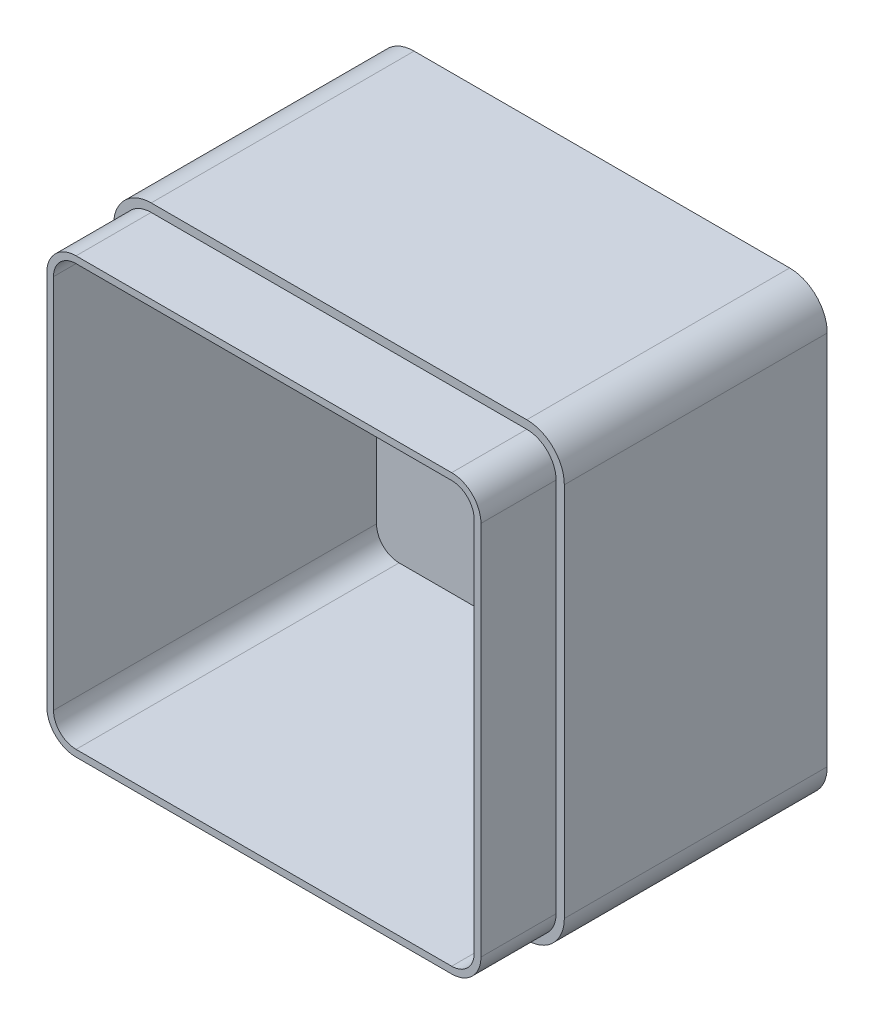
from build123d import *

# Parameters (mm, degrees)
SKETCH2_W           = 120
SKETCH2_H           = 120
BOSS_EXTRUDE1_DEPTH = 90
FILLET1_R           = 10
SHELL1_T            = -4
CUT_EXTRUDE1_DEPTH  = 20


with BuildPart() as part:
    # Sketch2 → Boss-Extrude1 (new body)
    with BuildSketch(Plane.XY):
        with Locations((60, 60)):
            Rectangle(SKETCH2_W, SKETCH2_H)
    extrude(amount=BOSS_EXTRUDE1_DEPTH)

    # Fillet1
    fillet1_edges = [part.edges().sort_by_distance(p)[0] for p in [
        (0, 120, 45),
        (120, 120, 45),
        (120, 0, 45),
        (0, 0, 45),
    ]]
    fillet(fillet1_edges, radius=FILLET1_R)

    # Shell1
    shell1_openings = [part.faces().sort_by_distance(p)[0] for p in [
        (60, 60, 90),
    ]]
    offset(amount=SHELL1_T, openings=shell1_openings, kind=Kind.INTERSECTION)

    # Sketch4 → Cut-Extrude1 (cut)
    with BuildSketch(Plane.XY.offset(90)):
        with BuildLine():
            Line((0, 110), (0, 10))
            ThreePointArc((0, 10), (2.928932188, 2.928932188), (10, 0))
            Line((10, 0), (110, 0))
            ThreePointArc((110, 0), (117.071067812, 2.928932188), (120, 10))
            Line((120, 10), (120, 110))
            ThreePointArc((120, 110), (117.071067812, 117.071067812), (110, 120))
            Line((110, 120), (10, 120))
            ThreePointArc((10, 120), (2.928932188, 117.071067812), (0, 110))
        make_face()
        with BuildLine():
            Line((2.2, 110), (2.2, 10))
            ThreePointArc((2.2, 10), (4.484567107, 4.484567107), (10, 2.2))
            Line((10, 2.2), (110, 2.2))
            ThreePointArc((110, 2.2), (115.515432893, 4.484567107), (117.8, 10))
            Line((117.8, 10), (117.8, 110))
            ThreePointArc((117.8, 110), (115.515432893, 115.515432893), (110, 117.8))
            Line((110, 117.8), (10, 117.8))
            ThreePointArc((10, 117.8), (4.484567107, 115.515432893), (2.2, 110))
        make_face(mode=Mode.SUBTRACT)
    extrude(amount=-CUT_EXTRUDE1_DEPTH, mode=Mode.SUBTRACT)


solid = part.part
